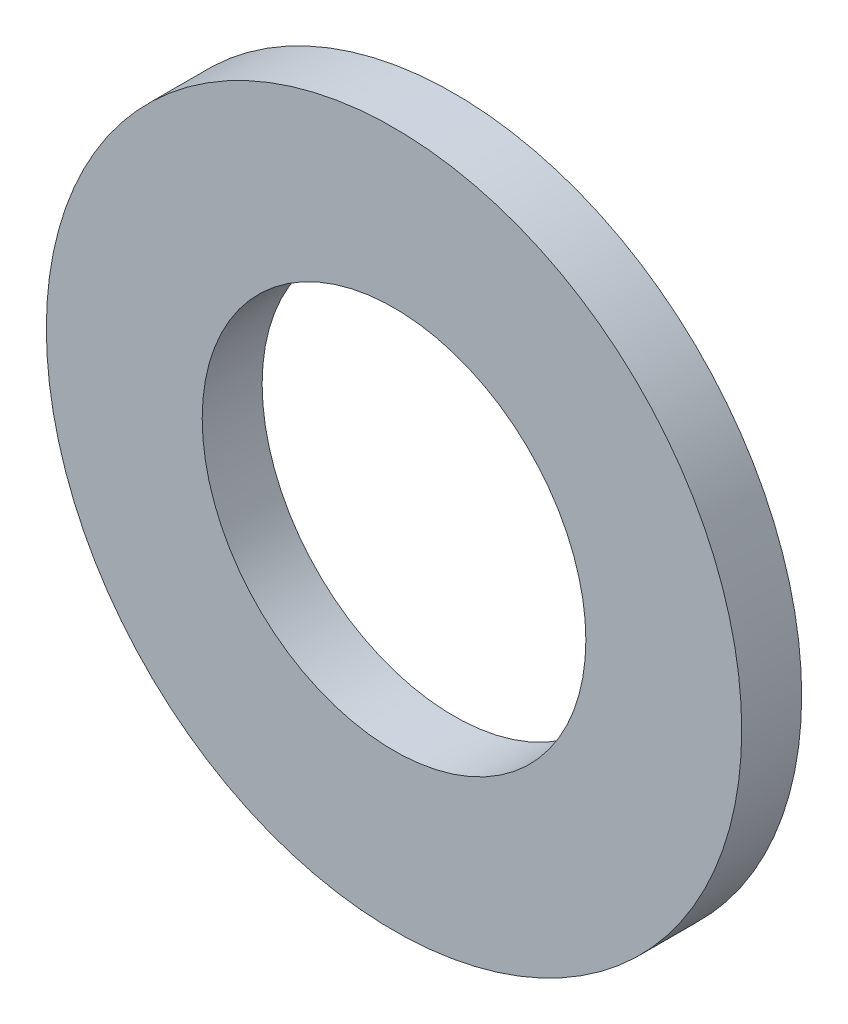
from build123d import *

# Parameters (mm, degrees)
SKETCH1_R                          = 3.5
SKETCH1_R_2                        = 1.6
WASHER_ENVELOPE_DEPTH              = 0.5
BENCH_DIN433_OD5P8_TRIM_DEPTH      = 5.974937186
BENCH_DIN433_OD5P8_TRIM_DEPTH_BACK = 5.974937186
SKETCH2_R                          = 3.8
SKETCH2_R_2                        = 2.9


with BuildPart() as part:
    # Sketch1 → Washer_Envelope (new body)
    with BuildSketch(Plane.XY):
        Circle(SKETCH1_R)
        Circle(SKETCH1_R_2, mode=Mode.SUBTRACT)
    extrude(amount=WASHER_ENVELOPE_DEPTH)

    # Sketch2 → Bench_DIN433_OD5p8_Trim (cut, two sides: drawn at the far end of the back side and taken through both)
    with BuildSketch(Plane.XY.offset(-BENCH_DIN433_OD5P8_TRIM_DEPTH_BACK)):
        Circle(SKETCH2_R)
        Circle(SKETCH2_R_2, mode=Mode.SUBTRACT)
    extrude(amount=BENCH_DIN433_OD5P8_TRIM_DEPTH + BENCH_DIN433_OD5P8_TRIM_DEPTH_BACK, mode=Mode.SUBTRACT)


solid = part.part
